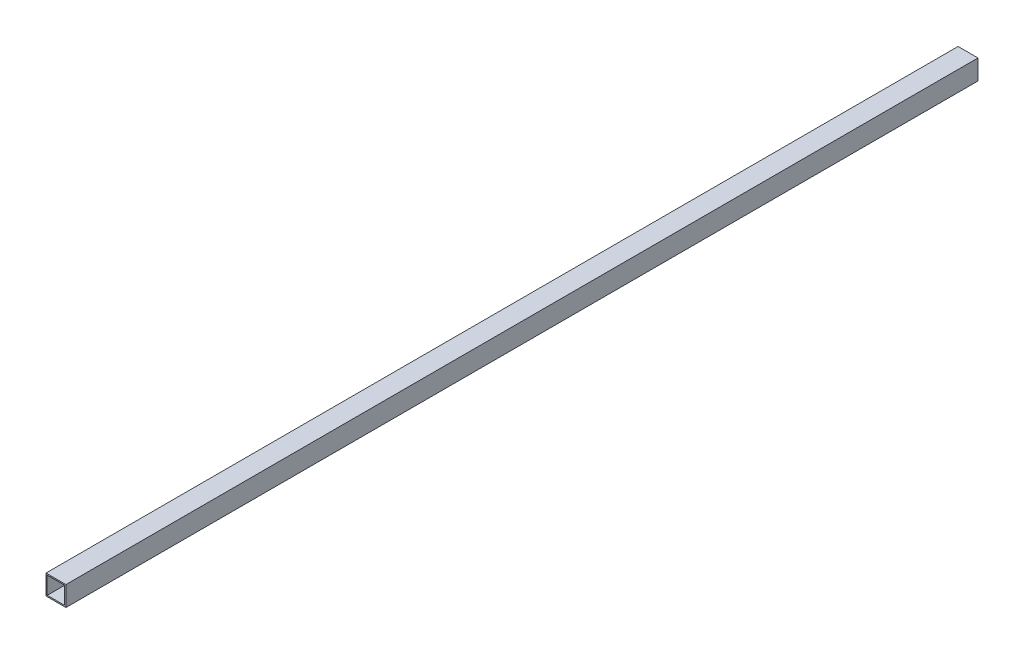
from build123d import *

# Parameters (mm, degrees)
SKETCH1_W           = 50.8
SKETCH1_H           = 50.8
SKETCH1_W_2         = 44.45
SKETCH1_H_2         = 44.45
BOSS_EXTRUDE1_DEPTH = 2324.1


with BuildPart() as part:
    # Sketch1 → Boss-Extrude1 (new body)
    with BuildSketch(Plane.XY):
        Rectangle(SKETCH1_W, SKETCH1_H)
        Rectangle(SKETCH1_W_2, SKETCH1_H_2, mode=Mode.SUBTRACT)
    extrude(amount=-BOSS_EXTRUDE1_DEPTH)


solid = part.part
